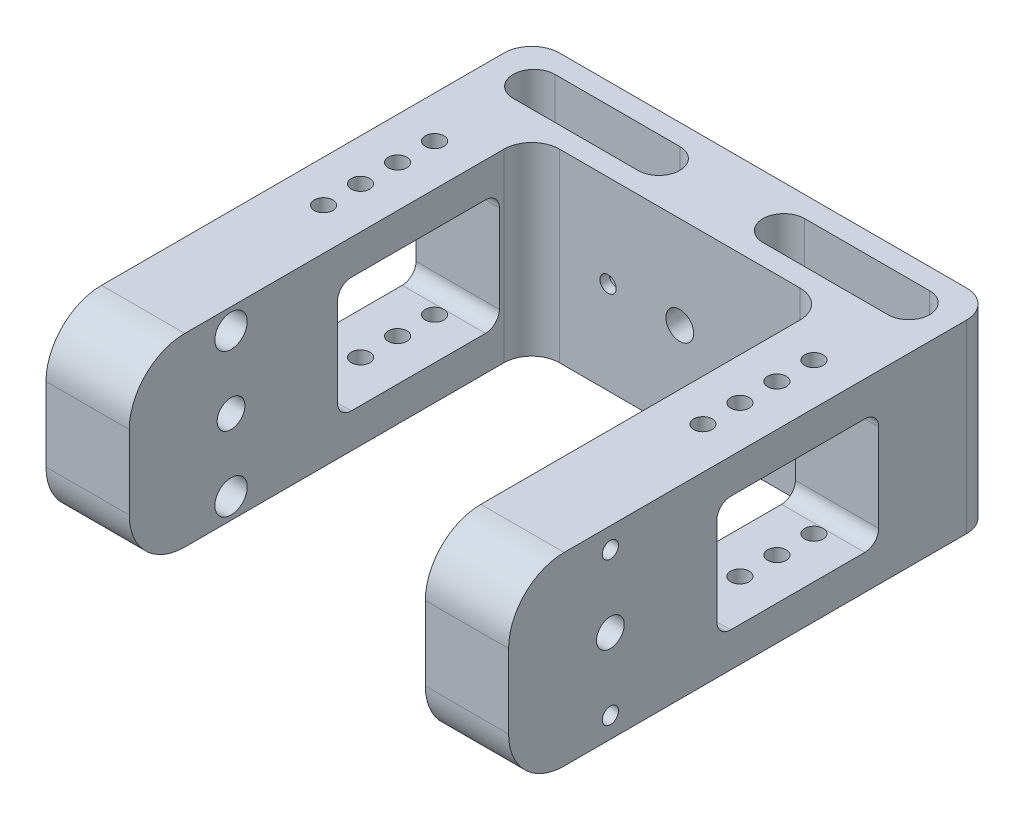
from build123d import *

# Parameters (mm, degrees)
EXTRUDE_1_DEPTH          = 20
SKETCH_2_R               = 3
SKETCH_2_R_2             = 1.75
CUT_EXTRUDE_1_DEPTH      = 112
CUT_EXTRUDE_2_DEPTH      = 123
CUT_EXTRUDE_2_DEPTH_BACK = 61
SKETCH_5_W               = 18
SKETCH_5_H               = 40
EXTRUDE_3_DEPTH          = 15
CUT_EXTRUDE_3_DEPTH      = 141.356688476
CUT_EXTRUDE_3_DEPTH_BACK = 141.356688476
SKETCH_6_R               = 2
CUT_EXTRUDE_4_DEPTH      = 141.356688476
CUT_EXTRUDE_4_DEPTH_BACK = 141.356688476
FILLET_1_R               = 6
FILLET_2_R               = 12
SKETCH_9_R               = 7.5
CUT_EXTRUDE_6_DEPTH      = 8
SKETCH_10_R              = 3
CUT_EXTRUDE_7_DEPTH      = 16
SKETCH_11_R              = 1.75
SKETCH_11_R_2            = 3
CUT_EXTRUDE_8_DEPTH      = 23
SKETCH_12_R              = 3.5
CUT_EXTRUDE_9_DEPTH      = 16
SKETCH_14_R              = 3.5
CUT_EXTRUDE_10_DEPTH     = 45


with BuildPart() as part:
    # 草图1 → 凸台-拉伸1 (new, symmetric)
    with BuildSketch(Plane(origin=(0, 0, 0), x_dir=(1, 0, 0), z_dir=(0, 1, 0))):
        Polygon((-18, 0), (0, 0), (0, 90), (-100, 90), (-100, 0), (-82, 0), (-82, 72), (-18, 72), align=None)
    extrude(amount=EXTRUDE_1_DEPTH, both=True)

    # 草图2 → 切除-拉伸1 (cut)
    with BuildSketch(Plane.ZY.offset(100)):
        with Locations((-7, 0)):
            Circle(SKETCH_2_R)
        with Locations((-7, 15.5)):
            Circle(SKETCH_2_R_2)
        with Locations((-7, -15.5)):
            Circle(SKETCH_2_R_2)
    extrude(amount=-CUT_EXTRUDE_1_DEPTH, mode=Mode.SUBTRACT)

    # 草图4 → 切除-拉伸2 (cut, two sides: drawn at the far end of the back side and taken through both)
    with BuildSketch(Plane.ZY.offset(18).offset(-CUT_EXTRUDE_2_DEPTH_BACK)):
        with BuildLine():
            Line((-62, 12.5), (-33, 12.5))
            ThreePointArc((-33, 12.5), (-30.878679656, 11.621320344), (-30, 9.5))
            Line((-30, 9.5), (-30, -9.5))
            ThreePointArc((-30, -9.5), (-30.878679656, -11.621320344), (-33, -12.5))
            Line((-33, -12.5), (-62, -12.5))
            ThreePointArc((-62, -12.5), (-64.121320344, -11.621320344), (-65, -9.5))
            Line((-65, -9.5), (-65, 9.5))
            ThreePointArc((-65, 9.5), (-64.121320344, 11.621320344), (-62, 12.5))
        make_face()
    extrude(amount=CUT_EXTRUDE_2_DEPTH + CUT_EXTRUDE_2_DEPTH_BACK, mode=Mode.SUBTRACT)

    # 草图5 → 凸台-拉伸3 (add)
    with BuildSketch(Plane.XY):
        with Locations((-9, 0)):
            Rectangle(SKETCH_5_W, SKETCH_5_H)
        with Locations((-91, 0)):
            Rectangle(SKETCH_5_W, SKETCH_5_H)
    extrude(amount=EXTRUDE_3_DEPTH)

    # 草图6 → 切除-拉伸3 (cut, two sides: drawn at the far end of the back side and taken through both)
    with BuildSketch(Plane(origin=(0, 20, 0), x_dir=(1, 0, 0), z_dir=(0, 1, 0)).offset(-CUT_EXTRUDE_3_DEPTH_BACK)):
        with Locations(Location((-91, 60, 0), (0, 0, 270))):
            Circle(SKETCH_6_R)
        with Locations(Location((-91, 52, 0), (0, 0, 270))):
            Circle(SKETCH_6_R)
        with Locations(Location((-91, 44, 0), (0, 0, 270))):
            Circle(SKETCH_6_R)
        with Locations(Location((-91, 36, 0), (0, 0, 270))):
            Circle(SKETCH_6_R)
        with Locations(Location((-9, 36, 0), (0, 0, 270))):
            Circle(SKETCH_6_R)
        with Locations(Location((-9, 44, 0), (0, 0, 270))):
            Circle(SKETCH_6_R)
        with Locations(Location((-9, 52, 0), (0, 0, 270))):
            Circle(SKETCH_6_R)
        with Locations(Location((-9, 60, 0), (0, 0, 90))):
            Circle(SKETCH_6_R)
    extrude(amount=CUT_EXTRUDE_3_DEPTH + CUT_EXTRUDE_3_DEPTH_BACK, mode=Mode.SUBTRACT)

    # 草图7 → 切除-拉伸4 (cut, two sides: drawn at the far end of the back side and taken through both)
    with BuildSketch(Plane(origin=(0, 20, 0), x_dir=(1, 0, 0), z_dir=(0, 1, 0)).offset(-CUT_EXTRUDE_4_DEPTH_BACK)):
        with BuildLine():
            Line((-90.5, 85.5), (-63.5, 85.5))
            ThreePointArc((-63.5, 85.5), (-59, 81), (-63.5, 76.5))
            Line((-63.5, 76.5), (-90.5, 76.5))
            ThreePointArc((-90.5, 76.5), (-95, 81), (-90.5, 85.5))
        make_face()
        with BuildLine():
            Line((-9.5, 85.5), (-36.5, 85.5))
            ThreePointArc((-36.5, 85.5), (-41, 81), (-36.5, 76.5))
            Line((-36.5, 76.5), (-9.5, 76.5))
            ThreePointArc((-9.5, 76.5), (-5, 81), (-9.5, 85.5))
        make_face()
    extrude(amount=CUT_EXTRUDE_4_DEPTH + CUT_EXTRUDE_4_DEPTH_BACK, mode=Mode.SUBTRACT)

    # 圆角1
    fillet_1_edges = [part.edges().sort_by_distance(p)[0] for p in [
        (-18, 0, -72),
        (-82, 0, -72),
        (-100, 0, -90),
        (0, 0, -90),
    ]]
    fillet(fillet_1_edges, radius=FILLET_1_R)

    # 圆角2
    fillet_2_edges = [part.edges().sort_by_distance(p)[0] for p in [
        (-9, -20, 15),
        (-9, 20, 15),
        (-91, -20, 15),
        (-91, 20, 15),
    ]]
    fillet(fillet_2_edges, radius=FILLET_2_R)

    # 草图9 → 切除-拉伸6 (cut)
    with BuildSketch(Plane(origin=(0, 0, -90), x_dir=(-1, 0, 0), z_dir=(0, 0, -1))):
        with Locations((50, 0)):
            Circle(SKETCH_9_R)
    extrude(amount=-CUT_EXTRUDE_6_DEPTH, mode=Mode.SUBTRACT)

    # 草图10 → 切除-拉伸7 (cut)
    with BuildSketch(Plane.XY.offset(-72)):
        with Locations((-50, 0)):
            Circle(SKETCH_10_R)
    extrude(amount=-CUT_EXTRUDE_7_DEPTH, mode=Mode.SUBTRACT)

    # 草图11 → 切除-拉伸8 (cut)
    with BuildSketch(Plane.XY.offset(-72)):
        with Locations((-34.5, 0)):
            Circle(SKETCH_11_R)
        with Locations((-65.5, 0)):
            Circle(SKETCH_11_R)
        with Locations((-50, 0)):
            Circle(SKETCH_11_R_2)
    extrude(amount=-CUT_EXTRUDE_8_DEPTH, mode=Mode.SUBTRACT)

    # 草图12 → 切除-拉伸9 (cut)
    with BuildSketch(Plane(origin=(0, 0, -90), x_dir=(-1, 0, 0), z_dir=(0, 0, -1))):
        with Locations((34.5, 0)):
            Circle(SKETCH_12_R)
        with Locations((65.5, 0)):
            Circle(SKETCH_12_R)
    extrude(amount=-CUT_EXTRUDE_9_DEPTH, mode=Mode.SUBTRACT)

    # 草图14 → 切除-拉伸10 (cut, symmetric)
    with BuildSketch(Plane(origin=(-50, 0, 0), x_dir=(0, 0, -1), z_dir=(1, 0, 0))):
        with Locations((7, 15.5)):
            Circle(SKETCH_14_R)
        with Locations((7, -15.5)):
            Circle(SKETCH_14_R)
    extrude(amount=CUT_EXTRUDE_10_DEPTH, both=True, mode=Mode.SUBTRACT)


solid = part.part
